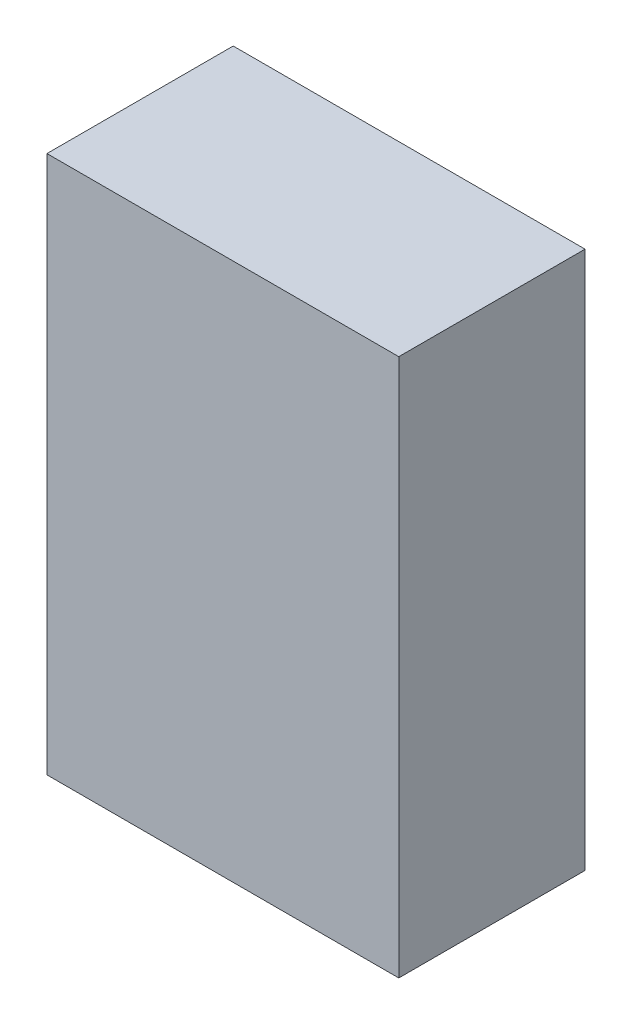
from build123d import *

# Parameters (mm, degrees)
SKETCH_1_W      = 34
SKETCH_1_H      = 52
EXTRUDE_1_DEPTH = 18


with BuildPart() as part:
    # 草图1 → 凸台-拉伸1 (new body)
    with BuildSketch(Plane.XY):
        Rectangle(SKETCH_1_W, SKETCH_1_H)
    extrude(amount=-EXTRUDE_1_DEPTH)


solid = part.part
